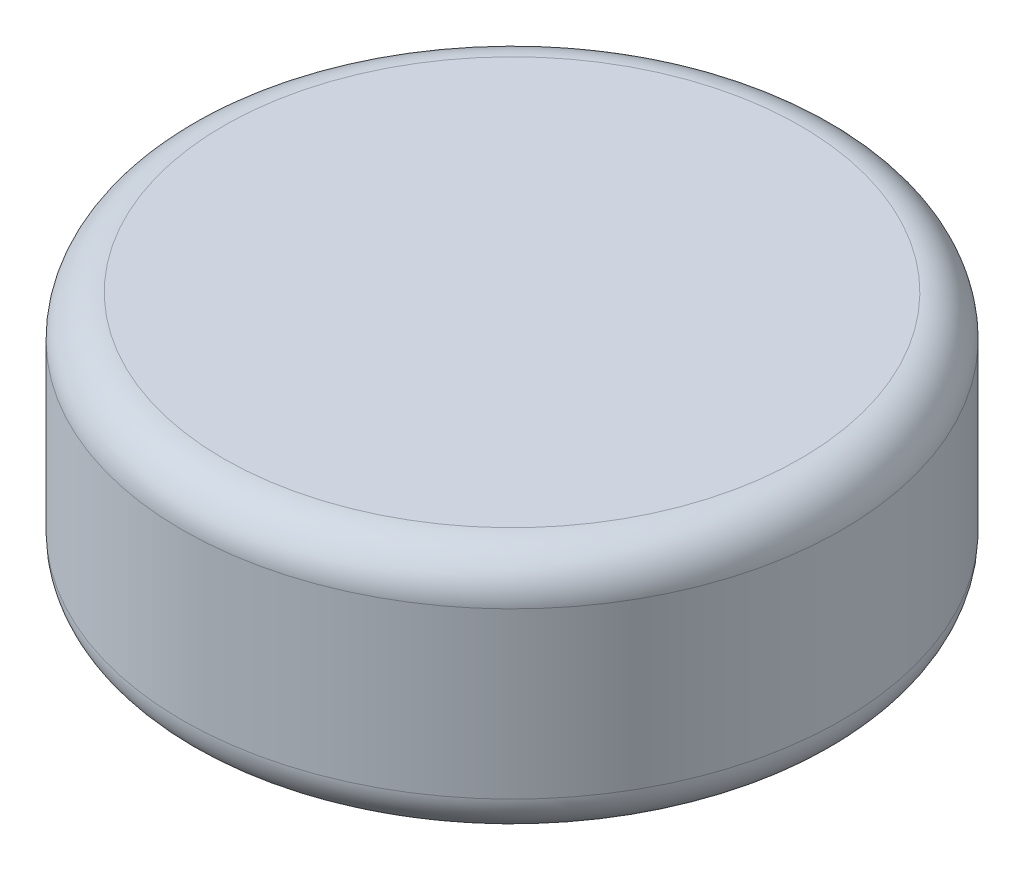
from build123d import *

# Parameters (mm, degrees)
SKETCH1_R           = 4
BOSS_EXTRUDE1_DEPTH = 3
FILLET1_R           = 0.5


with BuildPart() as part:
    # Sketch1 → Boss-Extrude1 (new body)
    with BuildSketch(Plane(origin=(0, 0, 0), x_dir=(1, 0, 0), z_dir=(0, 1, 0))):
        with Locations(Location((0, 0, 0), (0, 0, 270))):
            Circle(SKETCH1_R)
    extrude(amount=BOSS_EXTRUDE1_DEPTH)

    # Fillet1
    fillet1_edges = [part.edges().sort_by_distance(p)[0] for p in [
        (0, 0, -4),
        (0, 3, -4),
    ]]
    fillet(fillet1_edges, radius=FILLET1_R)


solid = part.part
